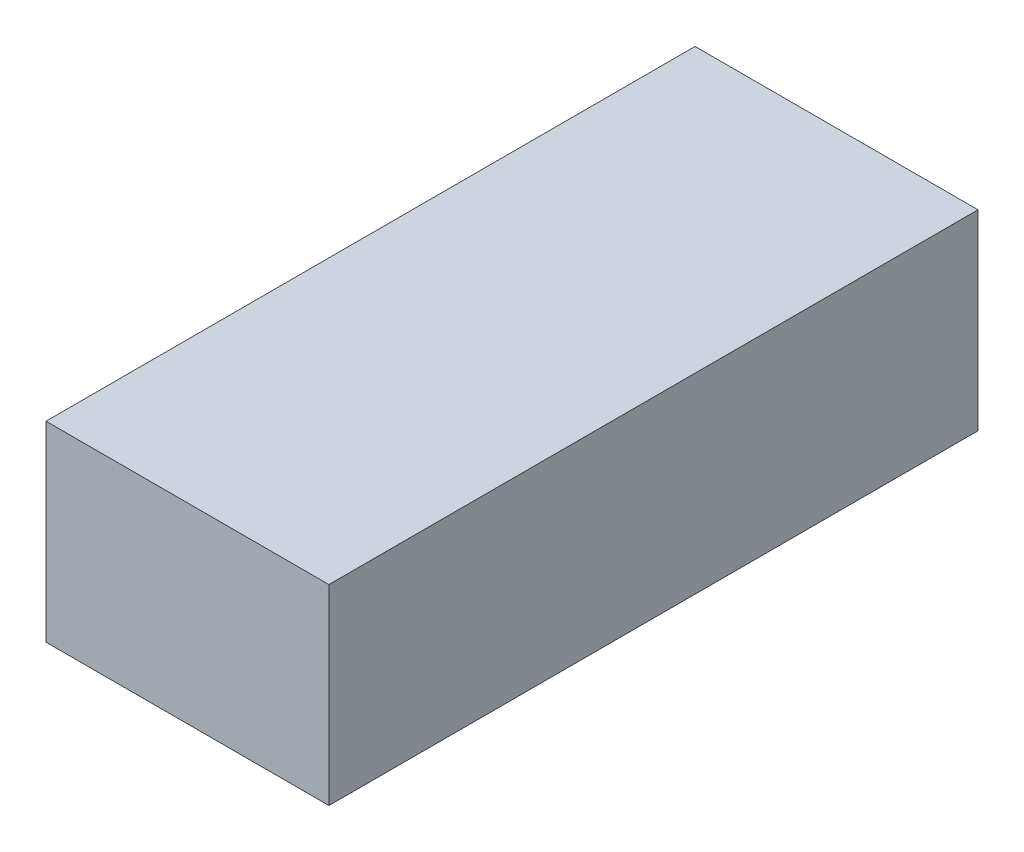
from build123d import *

# Parameters (mm, degrees)
SKETCH1_W           = 34
SKETCH1_H           = 78
BOSS_EXTRUDE1_DEPTH = 23


with BuildPart() as part:
    # Sketch1 → Boss-Extrude1 (new body)
    with BuildSketch(Plane(origin=(0, 0, 0), x_dir=(1, 0, 0), z_dir=(0, 1, 0))):
        with Locations((17, 39)):
            Rectangle(SKETCH1_W, SKETCH1_H)
    extrude(amount=BOSS_EXTRUDE1_DEPTH)


solid = part.part
